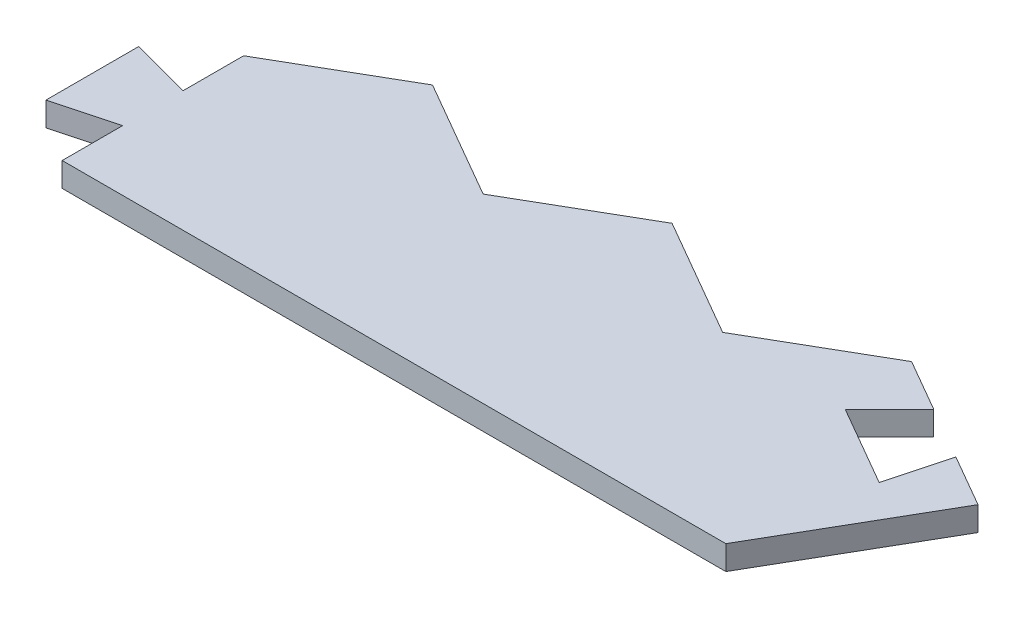
from build123d import *

# Parameters (mm, degrees)
BOSS_EXTRUDE1_DEPTH = 8


with BuildPart() as part:
    # Sketch1 → Boss-Extrude1 (new body)
    with BuildSketch(Plane(origin=(0, 0, 0), x_dir=(1, 0, 0), z_dir=(0, 1, 0))):
        Polygon((0, 0), (219.497025341, 0), (250.021534073, 52.87), (232.701025997, 62.87), (227.342042148, 42.87), (200.73950177, 58.228983849), (215.380517921, 72.87), (198.060009846, 82.87), (158.448007876, 60), (118.836005907, 82.87), (79.224003938, 60), (39.612001969, 82.87), (0, 60), (0, 40), (-20, 45.358983849), (-20, 14.641016151), (0, 20), align=None)
    extrude(amount=BOSS_EXTRUDE1_DEPTH)


solid = part.part
